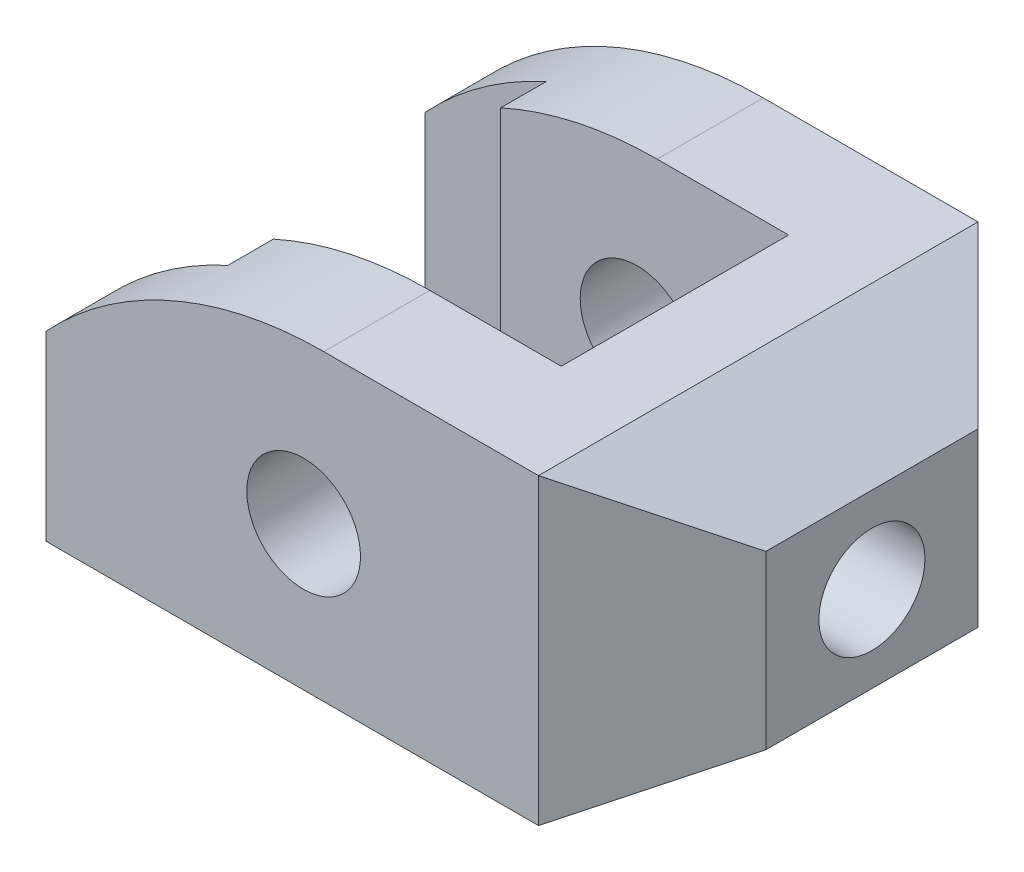
from build123d import *

# Parameters (mm, degrees)
SKETCH1_R           = 7.5
BOSS_EXTRUDE1_DEPTH = 29
CUT_EXTRUDE1_DEPTH  = 58
CUT_EXTRUDE2_DEPTH  = 58
SKETCH7_R           = 7
CUT_EXTRUDE3_DEPTH  = 58


with BuildPart() as part:
    # Sketch1 → Boss-Extrude1 (new, symmetric)
    with BuildSketch(Plane.XY):
        with BuildLine():
            Line((0, 0), (65, 0))
            Line((65, 0), (80, 8.660254038))
            Line((80, 8.660254038), (80, 31.339745962))
            Line((80, 31.339745962), (65, 40))
            Line((65, 40), (36.66060556, 40))
            ThreePointArc((36.66060556, 40), (16.66060556, 35.82575695), (0, 24))
            Line((0, 24), (0, 0))
        make_face()
        with Locations(Location((34, 19, 0), (0, 0, 180))):
            Circle(SKETCH1_R, mode=Mode.SUBTRACT)
    extrude(amount=BOSS_EXTRUDE1_DEPTH, both=True)

    # Sketch2 → Cut-Extrude1 (cut)
    with BuildSketch(Plane(origin=(0, 0, 0), x_dir=(1, 0, 0), z_dir=(0, 1, 0))):
        Polygon((0, 21), (16, 21), (16, 15), (54, 15), (54, -15), (16, -15), (16, -21), (0, -21), align=None)
    extrude(amount=CUT_EXTRUDE1_DEPTH, mode=Mode.SUBTRACT)

    # Sketch3 → Cut-Extrude2 (cut)
    with BuildSketch(Plane(origin=(0, 0, 0), x_dir=(1, 0, 0), z_dir=(0, 1, 0))):
        Polygon((80, 29), (65, 29), (80, 14), align=None)
        Polygon((80, -29), (65, -29), (80, -14), align=None)
    extrude(amount=CUT_EXTRUDE2_DEPTH, mode=Mode.SUBTRACT)

    # Sketch7 → Cut-Extrude3 (cut)
    with BuildSketch(Plane(origin=(80, 0, 0), x_dir=(0, 0, -1), z_dir=(1, 0, 0))):
        with Locations((0, 20)):
            Circle(SKETCH7_R)
    extrude(amount=-CUT_EXTRUDE3_DEPTH, mode=Mode.SUBTRACT)


solid = part.part
